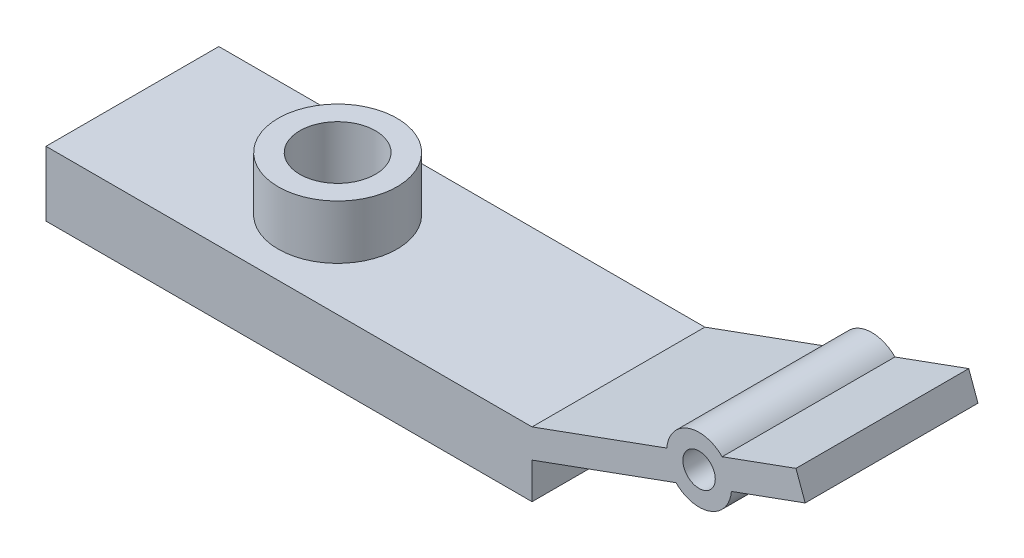
from build123d import *

# Parameters (mm, degrees)
SKETCH_1_R          = 3
EXTRUDE_1_DEPTH     = 32
SKETCH_2_R          = 11
SKETCH_2_R_2        = 7
EXTRUDE_4_DEPTH     = 10
SKETCH_2_5_R        = 7
CUT_EXTRUDE_1_DEPTH = 146.263175934


with BuildPart() as part:
    # 스케치1 → 보스-돌출1 (new body)
    with BuildSketch(Plane.XY):
        with BuildLine():
            Line((114.944745727, 21.079144946), (90, 12))
            Line((90, 12), (0, 12))
            Line((0, 12), (0, 0))
            Line((0, 0), (90, 0))
            Line((90, 0), (90, 6.679111138))
            Line((90, 6.679111138), (116.654846444, 16.380681842))
            ThreePointArc((116.654846444, 16.380681842), (122.977335083, 14.95725731), (126.90568272, 20.111681123))
            Line((126.90568272, 20.111681123), (140.574116997, 25.086584349))
            Line((140.574116997, 25.086584349), (138.864016281, 29.785047453))
            Line((138.864016281, 29.785047453), (125.195582003, 24.810144227))
            ThreePointArc((125.195582003, 24.810144227), (118.873093364, 26.233568759), (114.944745727, 21.079144946))
        make_face()
        with Locations((120.925214223, 20.595413034)):
            Circle(SKETCH_1_R, mode=Mode.SUBTRACT)
    extrude(amount=EXTRUDE_1_DEPTH)

    # 스케치2 → 보스-돌출4 (add)
    with BuildSketch(Plane(origin=(0, 12, 0), x_dir=(1, 0, 0), z_dir=(0, 1, 0))):
        with Locations((38, -16)):
            Circle(SKETCH_2_R)
        with Locations((38, -16)):
            Circle(SKETCH_2_R_2, mode=Mode.SUBTRACT)
    extrude(amount=EXTRUDE_4_DEPTH)

    # 스케치2<5> → 컷-돌출1 (cut, through all)
    with BuildSketch(Plane(origin=(0, 12, 0), x_dir=(1, 0, 0), z_dir=(0, 1, 0))):
        with Locations((38, -16)):
            Circle(SKETCH_2_5_R)
    extrude(amount=-CUT_EXTRUDE_1_DEPTH, mode=Mode.SUBTRACT)


solid = part.part
